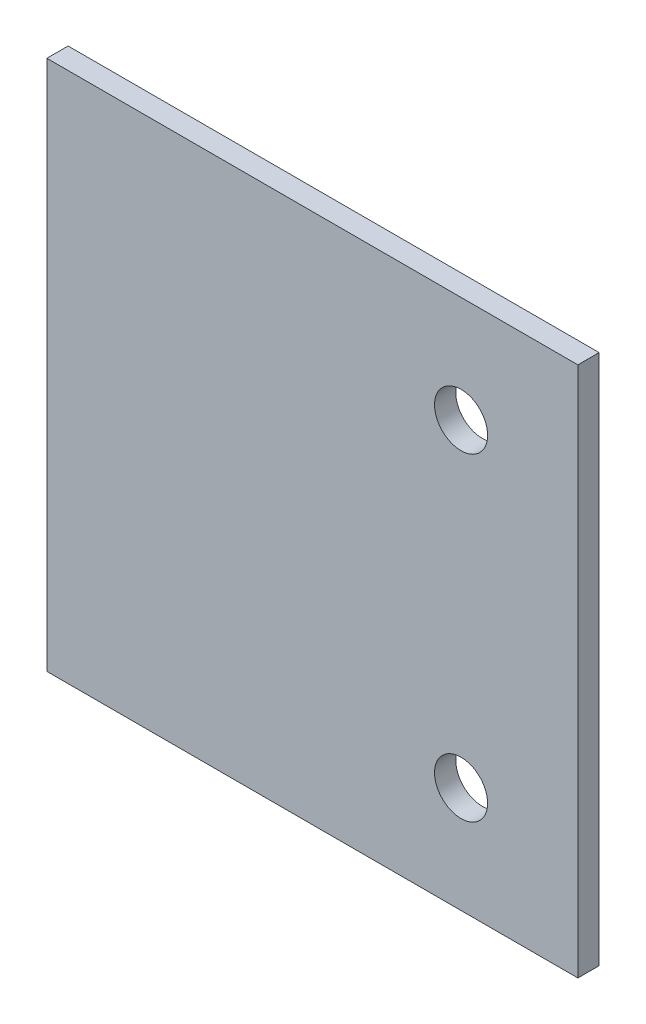
from build123d import *

# Parameters (mm, degrees)
SKETCH_2_W          = 50
SKETCH_2_H          = 50
EXTRUDE_1_DEPTH     = 2
SKETCH_4_R          = 2.5
CUT_EXTRUDE_1_DEPTH = 2


with BuildPart() as part:
    # 草图2 → 凸台-拉伸1 (new body)
    with BuildSketch(Plane.XY):
        Rectangle(SKETCH_2_W, SKETCH_2_H)
    extrude(amount=EXTRUDE_1_DEPTH)

    # 草图4 → 切除-拉伸1 (cut)
    with BuildSketch(Plane.XY.offset(2)):
        with Locations((14, -15)):
            Circle(SKETCH_4_R)
        with Locations((14, 15)):
            Circle(SKETCH_4_R)
    extrude(amount=-CUT_EXTRUDE_1_DEPTH, mode=Mode.SUBTRACT)


solid = part.part
